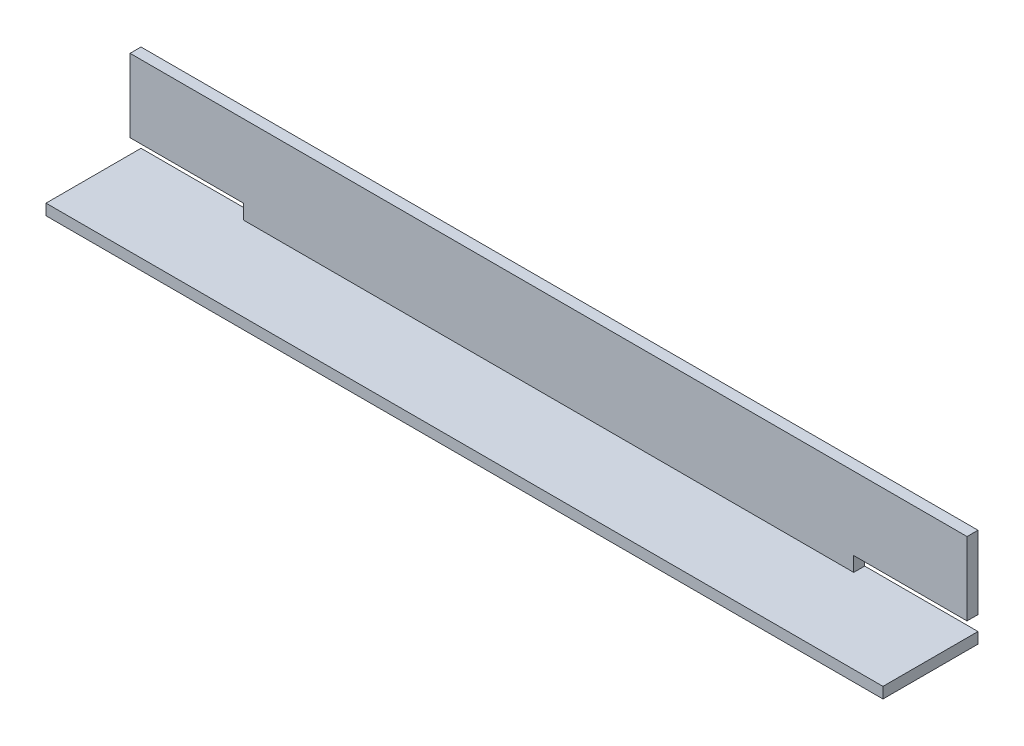
from build123d import *

# Parameters (mm, degrees)
SKETCH1_W           = 229
SKETCH1_H           = 26
BOSS_EXTRUDE1_DEPTH = 3
SKETCH2_W           = 229
SKETCH2_H           = 3
BOSS_EXTRUDE2_DEPTH = 24
SKETCH3_W           = 31
SKETCH3_H           = 4
CUT_EXTRUDE1_DEPTH  = 24


with BuildPart() as part:
    # Sketch1 → Boss-Extrude1 (new body)
    with BuildSketch(Plane(origin=(0, 0, 0), x_dir=(1, 0, 0), z_dir=(0, 1, 0))):
        with Locations((-114.5, -13)):
            Rectangle(SKETCH1_W, SKETCH1_H)
    extrude(amount=BOSS_EXTRUDE1_DEPTH)

    # Sketch2 → Boss-Extrude2 (add)
    with BuildSketch(Plane(origin=(0, 3, 0), x_dir=(1, 0, 0), z_dir=(0, 1, 0))):
        with Locations((-114.5, -1.5)):
            Rectangle(SKETCH2_W, SKETCH2_H)
    extrude(amount=BOSS_EXTRUDE2_DEPTH)

    # Sketch3 → Cut-Extrude1 (cut)
    with BuildSketch(Plane.XY.offset(3)):
        with Locations((-213.5, 5)):
            Rectangle(SKETCH3_W, SKETCH3_H)
        with Locations((-15.5, 5)):
            Rectangle(SKETCH3_W, SKETCH3_H)
    extrude(amount=-CUT_EXTRUDE1_DEPTH, mode=Mode.SUBTRACT)


solid = part.part
